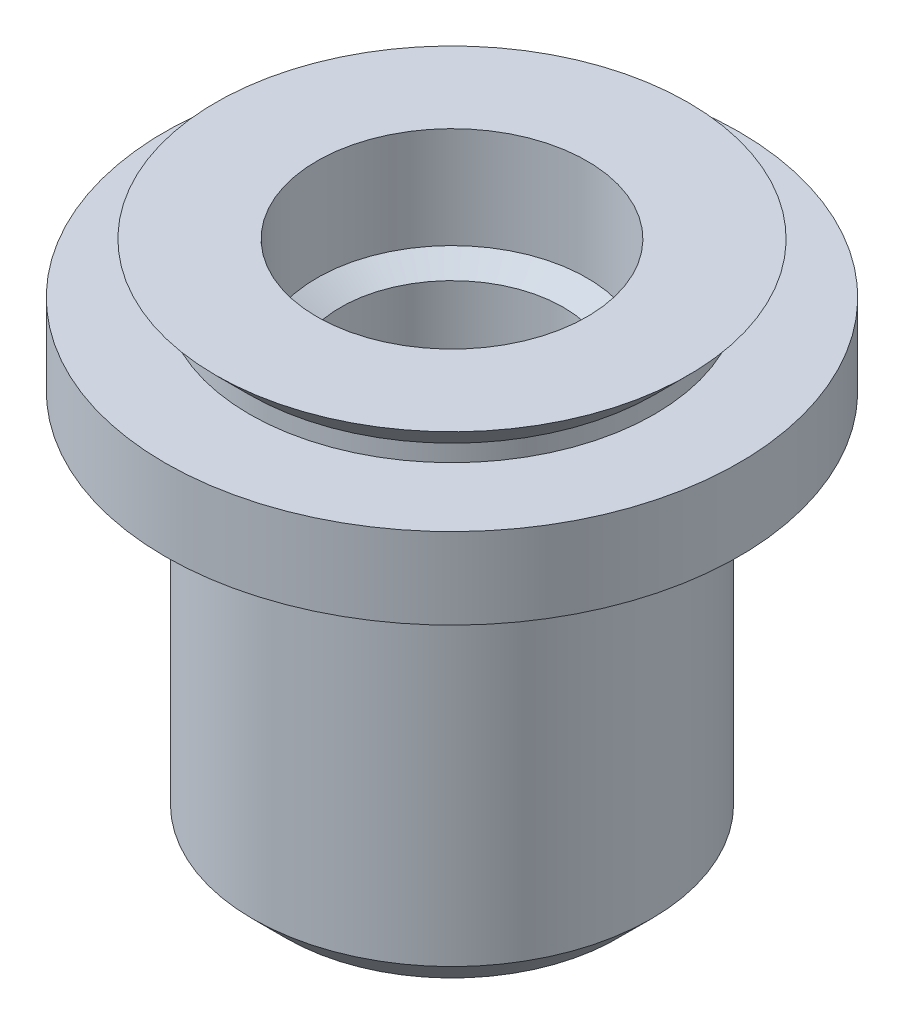
from build123d import *

# Parameters (mm, degrees)
BROCA_DE_ROSQUEAR_PARA_TARRAXA_DE_M41_D     = 3.3
BROCA_DE_ROSQUEAR_PARA_TARRAXA_DE_M41_DEPTH = 6.008579979
BROCA_DE_ROSQUEAR_PARA_TARRAXA_DE_M41_TIP   = 0.991420021


with BuildPart() as part:
    # Esboço1 → Revolução1 (revolve)
    with BuildSketch(Plane.XY, mode=Mode.PRIVATE) as revolu_o1_sk:
        Polygon((-2, 0), (-3.5, 0), (-3, -0.5), (-3, -0.75), (-4.25, -0.75), (-4.25, -1.95), (-2.95, -1.95), (-2.95, -7.25), (-2.45, -7.75), (0, -7.75), (0, -2), (-1.133974596, -2), (-2, -1.5), align=None)
    revolve(revolu_o1_sk.sketch.rotate(Axis((0, -2, 0), (0, -1, 0)), 270), axis=Axis((0, -2, 0), (0, -1, 0)))

    # Broca de rosquear para tarraxa de M41
    with Locations(Plane(origin=(0, 0, 0), x_dir=(1, 0, 0), z_dir=(0, 1, 0))):
        with Locations((0, 0)):
            Hole(BROCA_DE_ROSQUEAR_PARA_TARRAXA_DE_M41_D / 2, depth=BROCA_DE_ROSQUEAR_PARA_TARRAXA_DE_M41_DEPTH)
            with Locations((0, 0, -(BROCA_DE_ROSQUEAR_PARA_TARRAXA_DE_M41_DEPTH + BROCA_DE_ROSQUEAR_PARA_TARRAXA_DE_M41_TIP / 2))):  # 118° drill point
                Cone(0, BROCA_DE_ROSQUEAR_PARA_TARRAXA_DE_M41_D / 2, BROCA_DE_ROSQUEAR_PARA_TARRAXA_DE_M41_TIP, mode=Mode.SUBTRACT)


solid = part.part
